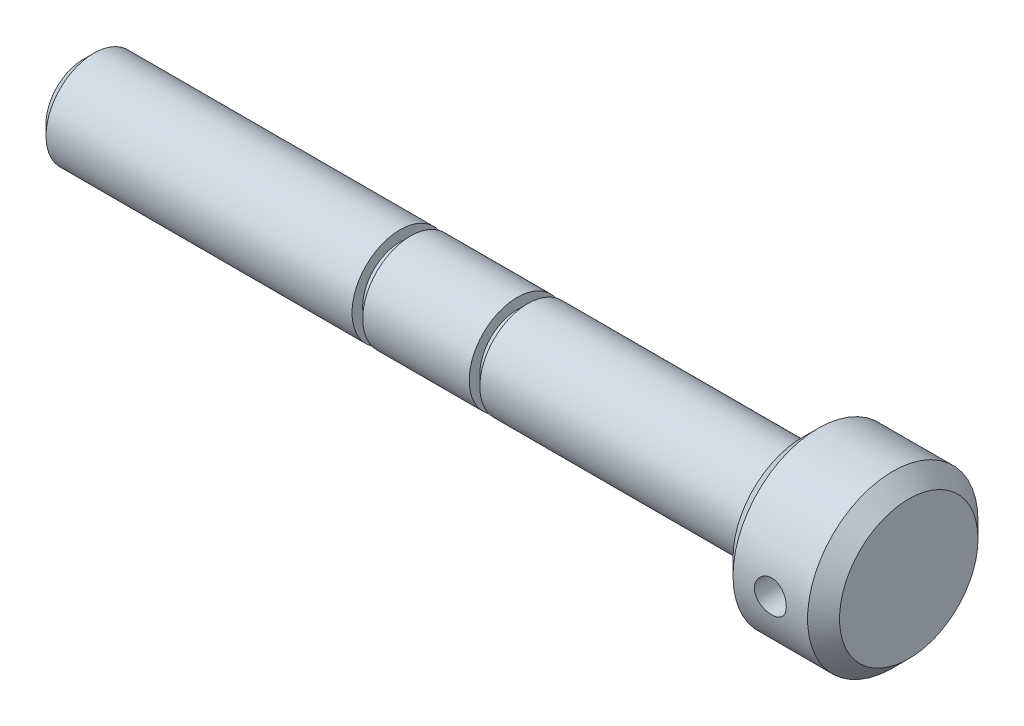
from build123d import *

# Parameters (mm, degrees)
CHAMFER1_SIZE      = 3
CHAMFER3_SIZE      = 3
CHAMFER4_SIZE      = 2
SKETCH2_R          = 3
CUT_EXTRUDE1_DEPTH = 50


with BuildPart() as part:
    # Sketch1 → Revolve1 (revolve)
    with BuildSketch(Plane.XY, mode=Mode.PRIVATE) as revolve1_sk:
        Polygon((0, 0), (0, 9), (59.46, 9), (59.46, 7), (61.46, 7), (61.46, 9), (81.46, 9), (81.46, 7), (83.46, 7), (83.46, 9), (135, 9), (135, 16), (155, 16), (155, 0), align=None)
    revolve(revolve1_sk.sketch.rotate(Axis((155, 0, 0), (-1, 0, 0)), 90), axis=Axis((155, 0, 0), (-1, 0, 0)))

    # Chamfer1
    chamfer1_edges = [part.edges().sort_by_distance(p)[0] for p in [
        (155, 0, 16),
    ]]
    chamfer(chamfer1_edges, length=CHAMFER1_SIZE)

    # Chamfer3
    chamfer3_edges = [part.edges().sort_by_distance(p)[0] for p in [
        (135, 0, 16),
    ]]
    chamfer(chamfer3_edges, length=CHAMFER3_SIZE)

    # Chamfer4
    chamfer4_edges = [part.edges().sort_by_distance(p)[0] for p in [
        (0, 0, 9),
    ]]
    chamfer(chamfer4_edges, length=CHAMFER4_SIZE)

    # Sketch2 → Cut-Extrude1 (cut, symmetric)
    with BuildSketch(Plane.XY):
        with Locations((145, 0)):
            Circle(SKETCH2_R)
    extrude(amount=CUT_EXTRUDE1_DEPTH, both=True, mode=Mode.SUBTRACT)


solid = part.part
